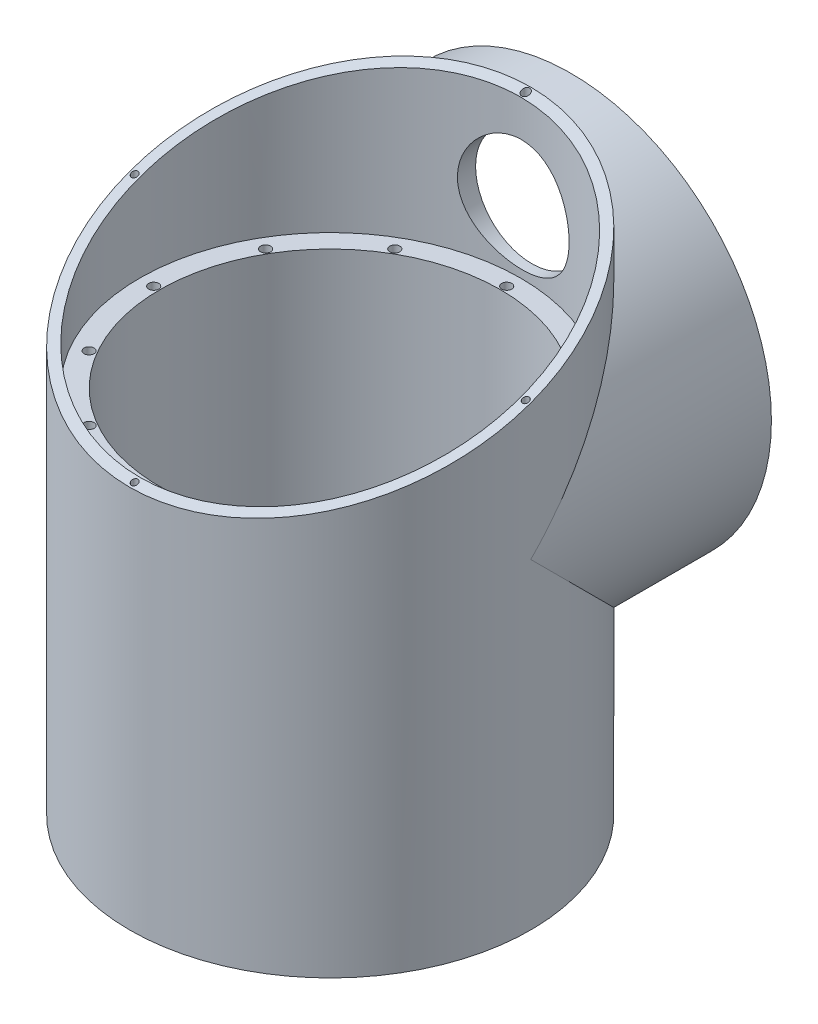
from build123d import *

# Parameters (mm, degrees)
SKETCH_1_R               = 50
EXTRUDE_1_DEPTH          = 60
EXTRUDE_2_DEPTH          = 52
EXTRUDE_2_DEPTH_BACK     = 80
SKETCH_2_R               = 50
SKETCH_3_R               = 25
CUT_EXTRUDE_1_DEPTH      = 179.952507666
SKETCH_4_R               = 42
CUT_EXTRUDE_2_DEPTH      = 23
PATTERN_CIRCULAR_1_COUNT = 12
SKETCH_7_R               = 42.49
CUT_EXTRUDE_3_DEPTH      = 97
SKETCH_8_R               = 47.5
CUT_EXTRUDE_4_DEPTH      = 40
PATTERN_CIRCULAR_2_COUNT = 12
CUT_EXTRUDE_5_DEPTH      = 145.913767462
CUT_EXTRUDE_5_DEPTH_BACK = 145.913767462
SKETCH_12_R              = 1
CUT_EXTRUDE_8_DEPTH      = 4
SKETCH_14_R              = 0.8
CUT_EXTRUDE_9_DEPTH      = 40
SKETCH_15_R              = 0.8
CUT_EXTRUDE_10_DEPTH     = 25
PATTERN_CIRCULAR_3_COUNT = 12
SKETCH_18_R              = 42.5
CUT_EXTRUDE_11_DEPTH     = 10
SKETCH_19_R              = 14
CUT_EXTRUDE_12_DEPTH     = 10


with BuildPart() as part:
    # 草图1 → 凸台-拉伸1 (new body)
    with BuildSketch(Plane.XY):
        Circle(SKETCH_1_R)
    extrude(amount=EXTRUDE_1_DEPTH)

    # 草图2 → 凸台-拉伸2 (add, two sides: drawn at the far end of the back side and taken through both)
    with BuildSketch(Plane(origin=(0, 0, 0), x_dir=(1, 0, 0), z_dir=(0, 1, 0)).offset(-EXTRUDE_2_DEPTH_BACK)):
        with Locations(Location((0, -60, 0), (0, 0, 270))):
            Circle(SKETCH_2_R)
    extrude(amount=EXTRUDE_2_DEPTH + EXTRUDE_2_DEPTH_BACK)

    # 草图3 → 切除-拉伸1 (cut, through all)
    with BuildSketch(Plane.XZ.offset(80)):
        with Locations(Location((0, 60, 0), (0, 0, 270))):
            Circle(SKETCH_3_R)
    extrude(amount=-CUT_EXTRUDE_1_DEPTH, mode=Mode.SUBTRACT)

    # 草图4 → 切除-拉伸2 (cut)
    with BuildSketch(Plane.XZ.offset(80)):
        with Locations(Location((0, 60, 0), (0, 0, 270))):
            Circle(SKETCH_4_R)
    extrude(amount=-CUT_EXTRUDE_2_DEPTH, mode=Mode.SUBTRACT)

    # 草图5 → M3 螺纹孔1 (revolve, cut)
    with BuildSketch(Plane(origin=(0, -57, 97), x_dir=(0, 0, -1), z_dir=(1, 0, 0))):
        Polygon((0, 0), (0, 8.251075774), (1.25, 7.5), (1.25, 0), align=None)
    hole_wizard_m3_1 = revolve(axis=Axis((0, -63.35, 97), (0, 1, 0)), mode=Mode.SUBTRACT)

    # 阵列(圆周)1: M3 螺纹孔1 ×12 about axis
    pattern_circular_1_axis = Axis((0, 0, 60), (0, 1, 0))
    for i in range(1, PATTERN_CIRCULAR_1_COUNT):
        add(hole_wizard_m3_1.rotate(pattern_circular_1_axis, i * 360 / PATTERN_CIRCULAR_1_COUNT), mode=Mode.SUBTRACT)

    # 草图7 → 切除-拉伸3 (cut)
    with BuildSketch(Plane(origin=(0, 52, 0), x_dir=(1, 0, 0), z_dir=(0, 1, 0))):
        with Locations(Location((0, -60, 0), (0, 0, 270))):
            Circle(SKETCH_7_R)
    extrude(amount=-CUT_EXTRUDE_3_DEPTH, mode=Mode.SUBTRACT)

    # 草图8 → 切除-拉伸4 (cut)
    with BuildSketch(Plane(origin=(0, 52, 0), x_dir=(1, 0, 0), z_dir=(0, 1, 0))):
        with Locations(Location((0, -60, 0), (0, 0, 270))):
            Circle(SKETCH_8_R)
    extrude(amount=-CUT_EXTRUDE_4_DEPTH, mode=Mode.SUBTRACT)

    # 草图9 → M3 螺纹孔2 (revolve, cut)
    with BuildSketch(Plane(origin=(0, 12, 16), x_dir=(0, 0, 1), z_dir=(1, 0, 0))):
        Polygon((0, 0), (0, 8.251075774), (1.25, 7.5), (1.25, 0), align=None)
    hole_wizard_m3_2 = revolve(axis=Axis((0, 18.35, 16), (0, -1, 0)), mode=Mode.SUBTRACT)

    # 阵列(圆周)2: M3 螺纹孔2 ×12 about axis
    pattern_circular_2_axis = Axis((0, 0, 60), (0, 1, 0))
    for i in range(1, PATTERN_CIRCULAR_2_COUNT):
        add(hole_wizard_m3_2.rotate(pattern_circular_2_axis, i * 360 / PATTERN_CIRCULAR_2_COUNT), mode=Mode.SUBTRACT)

    # 草图11 → 切除-拉伸5 (cut, two sides: drawn at the far end of the back side and taken through both)
    with BuildSketch(Plane(origin=(0, 0, 0), x_dir=(0, 0, -1), z_dir=(1, 0, 0)).offset(-CUT_EXTRUDE_5_DEPTH_BACK)):
        Polygon((-10, 52), (-110, 52), (-110, 15.602976573), align=None)
    extrude(amount=CUT_EXTRUDE_5_DEPTH + CUT_EXTRUDE_5_DEPTH_BACK, mode=Mode.SUBTRACT)

    # 草图12 → 切除-拉伸8 (cut)
    with BuildSketch(Plane(origin=(0, 52, 0), x_dir=(-1, 0, 0), z_dir=(0, -1, 0))):
        with Locations(Location((0, -11.25, 0), (0, 0, 90))):
            Circle(SKETCH_12_R)
    extrude(amount=CUT_EXTRUDE_8_DEPTH, mode=Mode.SUBTRACT)

    # 草图14 → 切除-拉伸9 (cut)
    with BuildSketch(Plane(origin=(0, 52, 0), x_dir=(-1, 0, 0), z_dir=(0, -1, 0))):
        with Locations(Location((0, -108.75, 0), (0, 0, 90))):
            Circle(SKETCH_14_R)
    extrude(amount=CUT_EXTRUDE_9_DEPTH, mode=Mode.SUBTRACT)

    # 草图15 → 切除-拉伸10 (cut)
    with BuildSketch(Plane(origin=(0, 52, 0), x_dir=(-1, 0, 0), z_dir=(0, -1, 0))):
        with Locations(Location((48.75, -60, 0), (0, 0, 90))):
            Circle(SKETCH_15_R)
        with Locations(Location((-48.75, -60, 0), (0, 0, 90))):
            Circle(SKETCH_15_R)
    extrude(amount=CUT_EXTRUDE_10_DEPTH, mode=Mode.SUBTRACT)

    # 草图16 → M3 螺纹孔3 (revolve, cut)
    with BuildSketch(Plane(origin=(0, 46, 0), x_dir=(0, 1, 0), z_dir=(1, 0, 0))):
        Polygon((0, 0), (0, 8.251075774), (1.25, 7.5), (1.25, 0), align=None)
    hole_wizard_m3_3 = revolve(axis=Axis((0, 46, -6.35), (0, 0, 1)), mode=Mode.SUBTRACT)

    # 阵列(圆周)3: M3 螺纹孔3 ×12 about axis
    pattern_circular_3_axis = Axis((0, 0, 0), (0, 0, 1))
    for i in range(1, PATTERN_CIRCULAR_3_COUNT):
        add(hole_wizard_m3_3.rotate(pattern_circular_3_axis, i * 360 / PATTERN_CIRCULAR_3_COUNT), mode=Mode.SUBTRACT)

    # 草图18 → 切除-拉伸11 (cut)
    with BuildSketch(Plane(origin=(0, 0, 0), x_dir=(-1, 0, 0), z_dir=(0, 0, -1))):
        Circle(SKETCH_18_R)
    extrude(amount=-CUT_EXTRUDE_11_DEPTH, mode=Mode.SUBTRACT)

    # 草图19 → 切除-拉伸12 (cut)
    with BuildSketch(Plane(origin=(0, 0, 10), x_dir=(-1, 0, 0), z_dir=(0, 0, -1))):
        with Locations((-0.249858735, 28)):
            Circle(SKETCH_19_R)
    extrude(amount=-CUT_EXTRUDE_12_DEPTH, mode=Mode.SUBTRACT)


solid = part.part
